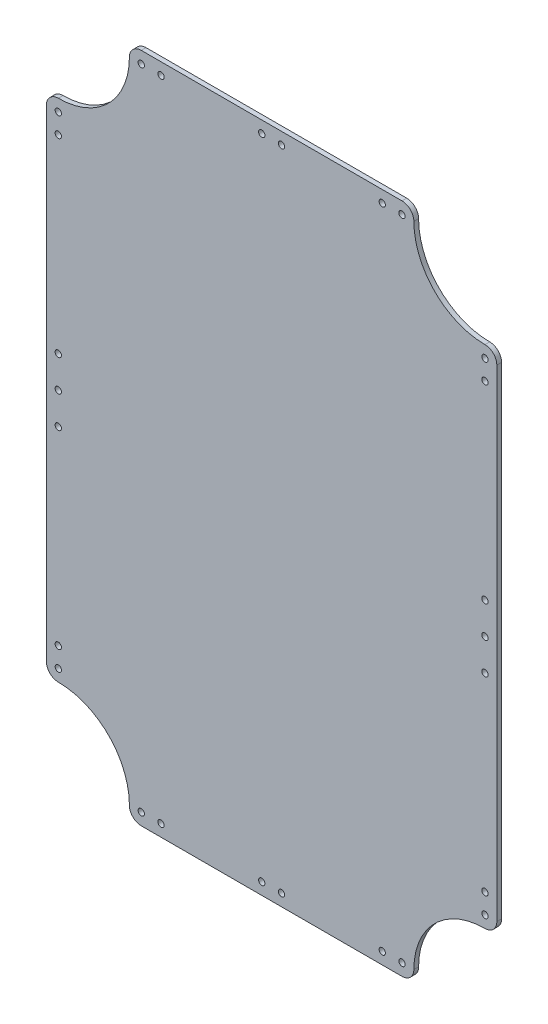
from build123d import *

# Parameters (mm, degrees)
SKETCH1_R           = 2
BOSS_EXTRUDE1_DEPTH = 3


with BuildPart() as part:
    # Sketch1 → Boss-Extrude1 (new body)
    with BuildSketch(Plane(origin=(0, 0, 0), x_dir=(-1, 0, 0), z_dir=(0, 0, -1))):
        with BuildLine():
            Line((-82.5, -212.5), (82.5, -212.5))
            ThreePointArc((82.5, -212.5), (87.803300859, -210.303300859), (90, -205))
            ThreePointArc((90, -205), (103.180194847, -173.180194847), (135, -160))
            ThreePointArc((135, -160), (140.303300859, -157.803300859), (142.5, -152.5))
            Line((142.5, -152.5), (142.5, 152.5))
            ThreePointArc((142.5, 152.5), (140.303300859, 157.803300859), (135, 160))
            ThreePointArc((135, 160), (103.180194847, 173.180194847), (90, 205))
            ThreePointArc((90, 205), (87.803300859, 210.303300859), (82.5, 212.5))
            Line((82.5, 212.5), (-82.5, 212.5))
            ThreePointArc((-82.5, 212.5), (-87.803300859, 210.303300859), (-90, 205))
            ThreePointArc((-90, 205), (-103.180194847, 173.180194847), (-135, 160))
            ThreePointArc((-135, 160), (-140.303300859, 157.803300859), (-142.5, 152.5))
            Line((-142.5, 152.5), (-142.5, -152.5))
            ThreePointArc((-142.5, -152.5), (-140.303300859, -157.803300859), (-135, -160))
            ThreePointArc((-135, -160), (-103.180194847, -173.180194847), (-90, -205))
            ThreePointArc((-90, -205), (-87.803300859, -210.303300859), (-82.5, -212.5))
        make_face()
        with Locations((-135, 20)):
            Circle(SKETCH1_R, mode=Mode.SUBTRACT)
        with Locations(Location((-135, -140, 0), (0, 0, 180))):
            Circle(SKETCH1_R, mode=Mode.SUBTRACT)
        with Locations(Location((-82.5, -205, 0), (0, 0, 180))):
            Circle(SKETCH1_R, mode=Mode.SUBTRACT)
        with Locations(Location((-6.25, -205, 0), (0, 0, 180))):
            Circle(SKETCH1_R, mode=Mode.SUBTRACT)
        with Locations((135, 20)):
            Circle(SKETCH1_R, mode=Mode.SUBTRACT)
        with Locations(Location((135, 140, 0), (0, 0, 180))):
            Circle(SKETCH1_R, mode=Mode.SUBTRACT)
        with Locations(Location((82.5, 205, 0), (0, 0, 180))):
            Circle(SKETCH1_R, mode=Mode.SUBTRACT)
        with Locations(Location((70, 205, 0), (0, 0, 180))):
            Circle(SKETCH1_R, mode=Mode.SUBTRACT)
        with Locations(Location((135, 152.5, 0), (0, 0, 180))):
            Circle(SKETCH1_R, mode=Mode.SUBTRACT)
        with Locations((135, 0)):
            Circle(SKETCH1_R, mode=Mode.SUBTRACT)
        with Locations((135, -20)):
            Circle(SKETCH1_R, mode=Mode.SUBTRACT)
        with Locations((-135, 0)):
            Circle(SKETCH1_R, mode=Mode.SUBTRACT)
        with Locations(Location((135, -140, 0), (0, 0, 180))):
            Circle(SKETCH1_R, mode=Mode.SUBTRACT)
        with Locations(Location((135, -152.5, 0), (0, 0, 180))):
            Circle(SKETCH1_R, mode=Mode.SUBTRACT)
        with Locations(Location((82.5, -205, 0), (0, 0, 180))):
            Circle(SKETCH1_R, mode=Mode.SUBTRACT)
        with Locations(Location((70, -205, 0), (0, 0, 180))):
            Circle(SKETCH1_R, mode=Mode.SUBTRACT)
        with Locations(Location((6.25, -205, 0), (0, 0, 180))):
            Circle(SKETCH1_R, mode=Mode.SUBTRACT)
        with Locations(Location((-70, -205, 0), (0, 0, 180))):
            Circle(SKETCH1_R, mode=Mode.SUBTRACT)
        with Locations(Location((-135, -152.5, 0), (0, 0, 180))):
            Circle(SKETCH1_R, mode=Mode.SUBTRACT)
        with Locations((-135, -20)):
            Circle(SKETCH1_R, mode=Mode.SUBTRACT)
        with Locations(Location((-135, 140, 0), (0, 0, 180))):
            Circle(SKETCH1_R, mode=Mode.SUBTRACT)
        with Locations(Location((6.25, 205, 0), (0, 0, 180))):
            Circle(SKETCH1_R, mode=Mode.SUBTRACT)
        with Locations(Location((-6.25, 205, 0), (0, 0, 180))):
            Circle(SKETCH1_R, mode=Mode.SUBTRACT)
        with Locations(Location((-70, 205, 0), (0, 0, 180))):
            Circle(SKETCH1_R, mode=Mode.SUBTRACT)
        with Locations(Location((-135, 152.5, 0), (0, 0, 180))):
            Circle(SKETCH1_R, mode=Mode.SUBTRACT)
        with Locations(Location((-82.5, 205, 0), (0, 0, 180))):
            Circle(SKETCH1_R, mode=Mode.SUBTRACT)
    extrude(amount=-BOSS_EXTRUDE1_DEPTH)


solid = part.part
